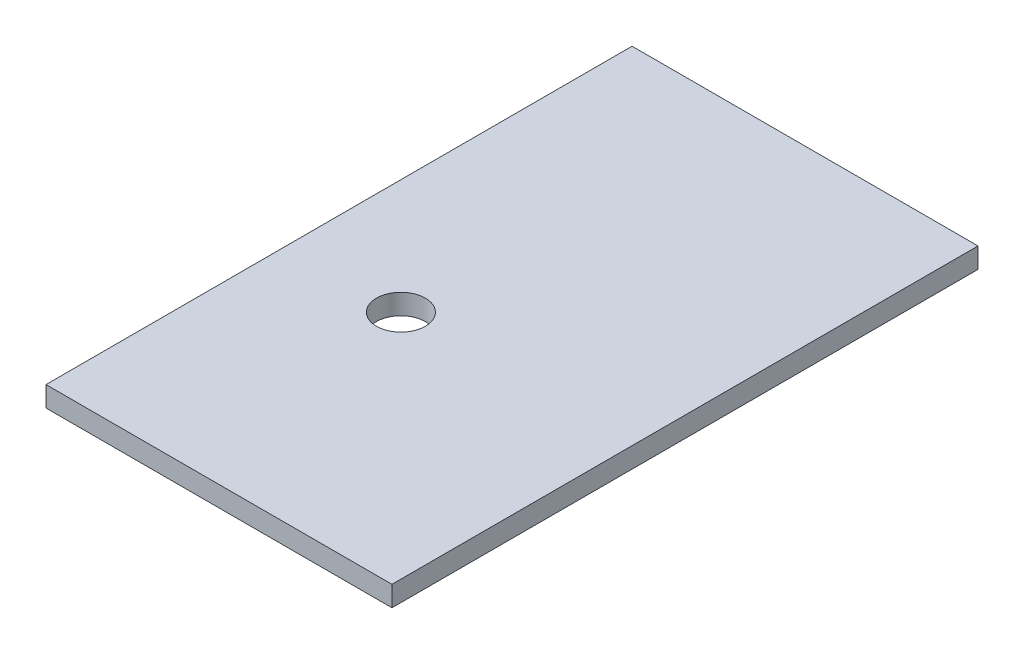
from build123d import *

# Parameters (mm, degrees)
SKETCH1_W           = 42.5
SKETCH1_H           = 72
SKETCH1_R           = 3
BOSS_EXTRUDE1_DEPTH = 2.5


with BuildPart() as part:
    # Sketch1 → Boss-Extrude1 (new body)
    with BuildSketch(Plane(origin=(0, 0, 0), x_dir=(1, 0, 0), z_dir=(0, 1, 0))):
        Rectangle(SKETCH1_W, SKETCH1_H)
        with Locations(Location((-7.149568334, -6.5, 0), (0, 0, 270))):
            Circle(SKETCH1_R, mode=Mode.SUBTRACT)
    extrude(amount=BOSS_EXTRUDE1_DEPTH)


solid = part.part
